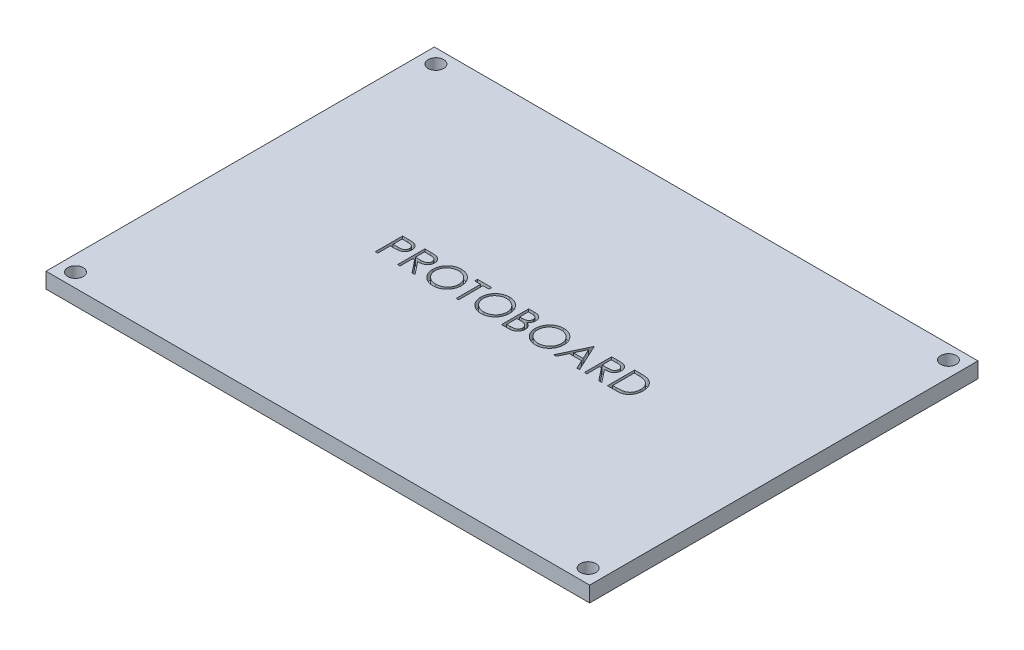
from build123d import *

# Parameters (mm, degrees)
SZKIC1_W                    = 70
SZKIC1_H                    = 50
DODANIE_WYCI_GNI_CIE1_DEPTH = 2
SZKIC2_R                    = 1
WYTNIJ_WYCI_GNI_CIE1_DEPTH  = 2
WYTNIJ_WYCI_GNI_CIE2_DEPTH  = 1


with BuildPart() as part:
    # Szkic1 → Dodanie-wyciągnięcie1 (new body)
    with BuildSketch(Plane(origin=(0, 0, 0), x_dir=(1, 0, 0), z_dir=(0, 1, 0))):
        Rectangle(SZKIC1_W, SZKIC1_H)
    extrude(amount=DODANIE_WYCI_GNI_CIE1_DEPTH)

    # Szkic2 → Wytnij-wyciągnięcie1 (cut)
    with BuildSketch(Plane(origin=(0, 2, 0), x_dir=(1, 0, 0), z_dir=(0, 1, 0))):
        with Locations(Location((-33, 23.2, 0), (0, 0, 270))):
            Circle(SZKIC2_R)
        with Locations(Location((33, 23.2, 0), (0, 0, 270))):
            Circle(SZKIC2_R)
        with Locations(Location((-33, -23.2, 0), (0, 0, 270))):
            Circle(SZKIC2_R)
        with Locations(Location((33, -23.2, 0), (0, 0, 270))):
            Circle(SZKIC2_R)
    extrude(amount=-WYTNIJ_WYCI_GNI_CIE1_DEPTH, mode=Mode.SUBTRACT)

    # Szkic3 → Wytnij-wyciągnięcie2 (cut)
    # profile 1 of 10: a face of its own
    with BuildSketch(Plane(origin=(0, 2, 0), x_dir=(1, 0, 0), z_dir=(0, 1, 0))):
        with BuildLine():
            Line((-15.969316975, 1.87298753), (-15.282918738, 1.87298753))
            add(Edge.make_bspline(
                [(-15.282918738, 1.87298753), (-15.235707831, 1.872935634), (-15.145249639, 1.872836198), (-15.015534583, 1.869821453), (-14.897724851, 1.86579476), (-14.79207447, 1.860212867), (-14.698258372, 1.853616277), (-14.616701073, 1.844364238), (-14.546761516, 1.834703942), (-14.504855067, 1.824882536), (-14.485743257, 1.820403395)],
                knots=[0, 0, 0, 0, 1.415646017, 2.712440637, 3.8905458, 4.950247383, 5.884950622, 6.709939814, 7.411656543, 8, 8, 8, 8], degree=3))
            add(Edge.make_bspline(
                [(-14.485743257, 1.820403395), (-14.461549723, 1.813781446), (-14.413732746, 1.800693584), (-14.344831703, 1.77447986), (-14.279277857, 1.743397695), (-14.216846299, 1.707973755), (-14.158304216, 1.666688191), (-14.102778175, 1.621214574), (-14.050758194, 1.570503005), (-14.002536803, 1.515122265), (-13.958252005, 1.456002055), (-13.920122322, 1.392259825), (-13.888195095, 1.324968522), (-13.860811824, 1.254174951), (-13.841103369, 1.179284627), (-13.82625647, 1.100817915), (-13.816832842, 1.018783225), (-13.81593028, 0.962723357), (-13.815470821, 0.934185447)],
                knots=[0, 0, 0, 0, 0.999701418, 1.975846123, 2.934577507, 3.890451536, 4.834027766, 5.787354733, 6.749476667, 7.726910423, 8.712836071, 9.690891519, 10.682875813, 11.679750201, 12.712814741, 13.765529915, 14.8625177, 16, 16, 16, 16], degree=3))
            add(Edge.make_bspline(
                [(-13.815470821, 0.934185447), (-13.815892246, 0.90540767), (-13.816716792, 0.849102006), (-13.826613077, 0.766729218), (-13.839943269, 0.688010828), (-13.860440321, 0.613121377), (-13.887285994, 0.542505607), (-13.918778047, 0.475084375), (-13.956761577, 0.412004703), (-14.000406407, 0.353037585), (-14.048958001, 0.298127673), (-14.102210939, 0.247672879), (-14.159950232, 0.20196854), (-14.22199238, 0.160912196), (-14.288942229, 0.125455917), (-14.359784382, 0.093698612), (-14.435134599, 0.067027551), (-14.487277113, 0.05299749), (-14.513788129, 0.045864133)],
                knots=[0, 0, 0, 0, 1.121902311, 2.195077645, 3.232258892, 4.234102512, 5.217864754, 6.176164875, 7.132989551, 8.084763148, 9.034132444, 9.988522005, 10.94243251, 11.903244335, 12.886203696, 13.894208494, 14.929344452, 16, 16, 16, 16], degree=3))
            add(Edge.make_bspline(
                [(-14.513788129, 0.045864133), (-14.535715463, 0.041201152), (-14.58377049, 0.030981957), (-14.662913212, 0.019573501), (-14.755058598, 0.0098359), (-14.860080878, 0.002534762), (-14.977885783, -0.003715606), (-15.10853704, -0.0086837), (-15.252291117, -0.011413554), (-15.352562361, -0.011554347), (-15.40491393, -0.011627855)],
                knots=[0, 0, 0, 0, 0.601384939, 1.31797006, 2.144135048, 3.087295005, 4.142315834, 5.309527816, 6.595305764, 8, 8, 8, 8], degree=3))
            Line((-15.40491393, -0.011627855), (-15.655214411, -0.011627855))
            Line((-15.655214411, -0.011627855), (-15.655214411, -1.62701247))
            Line((-15.655214411, -1.62701247), (-15.969316975, -1.62701247))
            Line((-15.969316975, -1.62701247), (-15.969316975, 1.87298753))
        make_face()
        with BuildLine():
            Line((-15.655214411, 1.514013171), (-15.655214411, 0.347346504))
            Line((-15.655214411, 0.347346504), (-15.042433962, 0.339634165))
            add(Edge.make_bspline(
                [(-15.042433962, 0.339634165), (-15.012514036, 0.339618701), (-14.954754236, 0.339588849), (-14.871318013, 0.343574072), (-14.793908726, 0.348174605), (-14.72276415, 0.354910529), (-14.657852216, 0.364431786), (-14.599064687, 0.374043524), (-14.546857404, 0.387948887), (-14.485758202, 0.406671956), (-14.417674855, 0.438604571), (-14.343607306, 0.484954461), (-14.28083672, 0.54403517), (-14.226518423, 0.610463001), (-14.183412545, 0.68436213), (-14.151856553, 0.763431067), (-14.133315396, 0.846858917), (-14.130829202, 0.903947056), (-14.129573385, 0.932783203)],
                knots=[0, 0, 0, 0, 1.160613943, 2.240541288, 3.23993089, 4.169200891, 5.011653406, 5.7853311, 6.478053781, 7.106038997, 8.262395093, 9.384106736, 10.481365981, 11.59014053, 12.70357646, 13.786202915, 14.881775077, 16, 16, 16, 16], degree=3))
            add(Edge.make_bspline(
                [(-14.129573385, 0.932783203), (-14.130836032, 0.960921717), (-14.133346016, 1.016857599), (-14.15200188, 1.098836359), (-14.183351194, 1.177072064), (-14.226807788, 1.250045149), (-14.279548918, 1.316233953), (-14.340848261, 1.37373108), (-14.410561522, 1.419952783), (-14.475409753, 1.449786065), (-14.533010939, 1.46800134), (-14.583042899, 1.48074618), (-14.639533574, 1.490921787), (-14.702501353, 1.499161289), (-14.771458187, 1.506214751), (-14.846996502, 1.511000728), (-14.928830145, 1.513802184), (-14.985640716, 1.513941139), (-15.015090212, 1.514013171)],
                knots=[0, 0, 0, 0, 1.120700087, 2.227813068, 3.331159281, 4.466773991, 5.599788987, 6.693661531, 7.80175334, 8.91857717, 9.525282508, 10.207424825, 10.974604443, 11.810962634, 12.737642355, 13.736264703, 14.826523623, 16, 16, 16, 16], degree=3))
            Line((-15.015090212, 1.514013171), (-15.655214411, 1.514013171))
        make_face(mode=Mode.SUBTRACT)
    # profile 2 of 10: a face of its own
    with BuildSketch(Plane(origin=(0, 2, 0), x_dir=(1, 0, 0), z_dir=(0, 1, 0))):
        with BuildLine():
            Line((-13.097522103, 1.87298753), (-12.39710143, 1.87298753))
            add(Edge.make_bspline(
                [(-12.39710143, 1.87298753), (-12.350360301, 1.872831944), (-12.260612157, 1.872533202), (-12.132038887, 1.870867439), (-12.01521179, 1.866093083), (-11.91019195, 1.8619845), (-11.816981295, 1.854492558), (-11.735294005, 1.847331911), (-11.665506307, 1.83795825), (-11.623260456, 1.829252828), (-11.60413268, 1.825311248)],
                knots=[0, 0, 0, 0, 1.410062039, 2.707475311, 3.878576406, 4.937260626, 5.877586885, 6.699081471, 7.410979367, 8, 8, 8, 8], degree=3))
            add(Edge.make_bspline(
                [(-11.60413268, 1.825311248), (-11.578526056, 1.818984483), (-11.527859066, 1.806465919), (-11.454909, 1.780006318), (-11.385394676, 1.749386694), (-11.319604852, 1.713422973), (-11.257869061, 1.671848194), (-11.19955075, 1.625380071), (-11.144385287, 1.574272865), (-11.094603656, 1.517238024), (-11.047664605, 1.457401514), (-11.008075978, 1.392697757), (-10.973949499, 1.32503623), (-10.946778982, 1.253728812), (-10.924901008, 1.17946704), (-10.909474769, 1.101578243), (-10.900223581, 1.020417268), (-10.899281725, 0.96505936), (-10.898804154, 0.936989934)],
                knots=[0, 0, 0, 0, 1.027469482, 2.033020251, 3.019912614, 3.986113645, 4.951240523, 5.91722682, 6.890402269, 7.87763091, 8.8651537, 9.85103654, 10.82876324, 11.815024772, 12.821070561, 13.842952187, 14.906261191, 16, 16, 16, 16], degree=3))
            add(Edge.make_bspline(
                [(-10.898804154, 0.936989934), (-10.900273152, 0.890354829), (-10.903139548, 0.799357661), (-10.929864652, 0.66729678), (-10.973641172, 0.544107465), (-11.033964461, 0.429944827), (-11.110783936, 0.327034182), (-11.203108727, 0.236643727), (-11.310990339, 0.161003814), (-11.411419655, 0.10855101), (-11.500133855, 0.074958101), (-11.573167167, 0.051321742), (-11.652834145, 0.033059777), (-11.738371479, 0.016699645), (-11.830135135, 0.004347951), (-11.927905174, -0.004698644), (-12.031751326, -0.010352693), (-12.103090395, -0.011194697), (-12.139789731, -0.011627855)],
                knots=[0, 0, 0, 0, 1.260483769, 2.459530307, 3.627416485, 4.787058657, 5.939039949, 7.08810263, 8.267026773, 9.491475466, 10.141966685, 10.831826277, 11.566392101, 12.351337768, 13.187381173, 14.07005841, 15.007169909, 16, 16, 16, 16], degree=3))
            Line((-12.139789731, -0.011627855), (-10.853932359, -1.62701247))
            Line((-10.853932359, -1.62701247), (-11.242353834, -1.62701247))
            Line((-11.242353834, -1.62701247), (-12.528211206, -0.011627855))
            Line((-12.528211206, -0.011627855), (-12.783419539, -0.011627855))
            Line((-12.783419539, -0.011627855), (-12.783419539, -1.62701247))
            Line((-12.783419539, -1.62701247), (-13.097522103, -1.62701247))
            Line((-13.097522103, -1.62701247), (-13.097522103, 1.87298753))
        make_face()
        with BuildLine():
            Line((-12.783419539, 1.514013171), (-12.783419539, 0.347346504))
            Line((-12.783419539, 0.347346504), (-12.142594218, 0.342438652))
            add(Edge.make_bspline(
                [(-12.142594218, 0.342438652), (-12.112674179, 0.342425415), (-12.054680622, 0.342399759), (-11.970779958, 0.346393535), (-11.892659846, 0.350936853), (-11.820619094, 0.357886199), (-11.754625518, 0.366842271), (-11.694712105, 0.378045255), (-11.640781053, 0.391097317), (-11.577882515, 0.411298943), (-11.507645983, 0.443304962), (-11.431314524, 0.48987046), (-11.366312186, 0.548439579), (-11.311394323, 0.615413035), (-11.267264892, 0.689049284), (-11.236152838, 0.768465654), (-11.216410395, 0.851657252), (-11.21408185, 0.908835359), (-11.212906718, 0.937691056)],
                knots=[0, 0, 0, 0, 1.146690395, 2.22261258, 3.21895312, 4.145990853, 4.996080663, 5.770904154, 6.481378293, 7.121626537, 8.300444488, 9.431385265, 10.535395872, 11.636531494, 12.74115979, 13.810798291, 14.895190096, 16, 16, 16, 16], degree=3))
            add(Edge.make_bspline(
                [(-11.212906718, 0.937691056), (-11.214108839, 0.965837629), (-11.216491005, 1.021613868), (-11.235939773, 1.103269778), (-11.268829155, 1.180336729), (-11.313151393, 1.252501214), (-11.367150548, 1.318006949), (-11.43046836, 1.374054102), (-11.501373555, 1.420303567), (-11.567644754, 1.449857948), (-11.626878966, 1.467977801), (-11.678308626, 1.480728965), (-11.736420104, 1.490973434), (-11.801495563, 1.499181495), (-11.873257193, 1.506236439), (-11.952067845, 1.510988217), (-12.037404625, 1.513802082), (-12.096551556, 1.51394117), (-12.127169539, 1.514013171)],
                knots=[0, 0, 0, 0, 1.101028733, 2.181837193, 3.264309656, 4.369019818, 5.486613113, 6.575447106, 7.666700264, 8.788928104, 9.402425223, 10.0903467, 10.862060571, 11.710948788, 12.657782767, 13.684531032, 14.801375019, 16, 16, 16, 16], degree=3))
            Line((-12.127169539, 1.514013171), (-12.783419539, 1.514013171))
        make_face(mode=Mode.SUBTRACT)
    # profile 3 of 10: a face of its own
    with BuildSketch(Plane(origin=(0, 2, 0), x_dir=(1, 0, 0), z_dir=(0, 1, 0))):
        with BuildLine():
            add(Edge.make_bspline(
                [(-8.498163129, 1.96273112), (-8.433355023, 1.96108964), (-8.306066556, 1.95786564), (-8.118991658, 1.933186536), (-7.940396563, 1.890491146), (-7.768826424, 1.833628164), (-7.606333447, 1.757773778), (-7.451694555, 1.66608863), (-7.305277681, 1.557612171), (-7.1690563, 1.433182944), (-7.044399349, 1.29779949), (-6.934573463, 1.15332158), (-6.842531169, 1.000622778), (-6.766945382, 0.840161947), (-6.707646772, 0.672301979), (-6.666727729, 0.496147977), (-6.640589579, 0.312841287), (-6.637533801, 0.187814422), (-6.635983641, 0.124389774)],
                knots=[0, 0, 0, 0, 1.065120563, 2.091984664, 3.0946048, 4.079830382, 5.057816894, 6.036188127, 7.030412546, 8.04752943, 9.064399622, 10.05169764, 11.02544977, 11.989514704, 12.962713494, 13.945757189, 14.957906945, 16, 16, 16, 16], degree=3))
            add(Edge.make_bspline(
                [(-6.635983641, 0.124389774), (-6.637533574, 0.061432327), (-6.640588671, -0.062664093), (-6.666757448, -0.244807537), (-6.707798448, -0.419898234), (-6.766394714, -0.587643887), (-6.841620193, -0.74822145), (-6.934275364, -0.901208404), (-7.043416575, -1.046654903), (-7.167623426, -1.182967568), (-7.303024468, -1.307965038), (-7.448254734, -1.416883914), (-7.600048054, -1.510608039), (-7.760357762, -1.585391713), (-7.927057799, -1.645163633), (-8.101640122, -1.685916263), (-8.283286676, -1.712203306), (-8.40715768, -1.715221822), (-8.470118257, -1.71675606)],
                knots=[0, 0, 0, 0, 1.043624062, 2.057103931, 3.04512605, 4.022047818, 4.998200453, 5.980619268, 6.982898556, 8.009068085, 9.034988726, 10.034168286, 11.015286542, 11.987931943, 12.962482838, 13.94673481, 14.956375938, 16, 16, 16, 16], degree=3))
            add(Edge.make_bspline(
                [(-8.470118257, -1.71675606), (-8.533542576, -1.715206673), (-8.658568792, -1.712152419), (-8.842105827, -1.685971014), (-9.018383571, -1.64502971), (-9.186897922, -1.586520274), (-9.347742852, -1.510903043), (-9.501232934, -1.418698664), (-9.646752082, -1.309291523), (-9.783093828, -1.185124948), (-9.907843026, -1.049953396), (-10.016602402, -0.905119141), (-10.108827515, -0.753463685), (-10.184190848, -0.594566161), (-10.243855307, -0.429194718), (-10.284560125, -0.25624624), (-10.310896077, -0.076706735), (-10.313930924, 0.045536164), (-10.315470821, 0.107562851)],
                knots=[0, 0, 0, 0, 1.053102029, 2.075944431, 3.073151272, 4.055350789, 5.033113405, 6.020478099, 7.024410459, 8.052272461, 9.079885166, 10.07527673, 11.055994387, 12.023226415, 12.992069828, 13.970394897, 14.97016774, 16, 16, 16, 16], degree=3))
            add(Edge.make_bspline(
                [(-10.315470821, 0.107562851), (-10.314936185, 0.14919552), (-10.313873659, 0.231935643), (-10.301081967, 0.354802243), (-10.282520265, 0.475692901), (-10.255918353, 0.594263849), (-10.221126686, 0.710224834), (-10.180074658, 0.824375597), (-10.129934813, 0.93555932), (-10.073254165, 1.044302712), (-10.009992357, 1.148910618), (-9.940116608, 1.247790201), (-9.866081239, 1.341771198), (-9.784917846, 1.428418202), (-9.6993014, 1.510251858), (-9.607843022, 1.586014575), (-9.511100778, 1.656389526), (-9.408658398, 1.719809867), (-9.303040123, 1.777169002), (-9.194163345, 1.826390853), (-9.083506774, 1.868636914), (-8.970552126, 1.90287774), (-8.855599354, 1.929909775), (-8.738397569, 1.948317129), (-8.619040143, 1.961141447), (-8.538628824, 1.962198949), (-8.498163129, 1.96273112)],
                knots=[0, 0, 0, 0, 1.037015668, 2.060948919, 3.074880161, 4.083647147, 5.086022904, 6.090072063, 7.104153813, 8.122640571, 9.144368836, 10.147691507, 11.138137339, 12.123020368, 13.103399296, 14.087645067, 15.080126199, 16.082011238, 17.087798457, 18.072939717, 19.057185487, 20.037253025, 21.01195951, 21.997135196, 22.992090687, 24, 24, 24, 24], degree=3))
        make_face()
        with BuildLine():
            add(Edge.make_bspline(
                [(-8.482738449, 1.603756761), (-8.515953083, 1.603351871), (-8.582064816, 1.602545961), (-8.680349352, 1.591930245), (-8.777341286, 1.576800356), (-8.873060648, 1.555218836), (-8.967106937, 1.525814783), (-9.060356778, 1.491973875), (-9.151959832, 1.450752784), (-9.24161369, 1.40418008), (-9.328528765, 1.352631159), (-9.410541467, 1.295659392), (-9.487864111, 1.234600838), (-9.560307377, 1.169313), (-9.62765855, 1.099463398), (-9.691243251, 1.026110962), (-9.748512833, 0.947159071), (-9.800998409, 0.864748664), (-9.84796625, 0.778987083), (-9.889731604, 0.690777221), (-9.923895613, 0.599399534), (-9.95175799, 0.505845377), (-9.9748578, 0.410262917), (-9.989491724, 0.311927068), (-10.000224084, 0.211331956), (-10.000983929, 0.143350102), (-10.001368257, 0.108965094)],
                knots=[0, 0, 0, 0, 1.008559885, 2.007477868, 2.99961109, 3.989939068, 4.984837346, 5.991145699, 7.001802488, 8.033829008, 9.059044045, 10.069351652, 11.065060232, 12.050310815, 13.029377138, 14.011219647, 14.996725999, 15.989392538, 16.977580475, 17.965360261, 18.951710183, 19.937753436, 20.929683414, 21.935841486, 22.955955122, 24, 24, 24, 24], degree=3))
            add(Edge.make_bspline(
                [(-10.001368257, 0.108965094), (-10.000093395, 0.058402873), (-9.997585347, -0.041068657), (-9.975627777, -0.186836801), (-9.941805802, -0.326925087), (-9.891948436, -0.460566996), (-9.829597821, -0.588911279), (-9.752570931, -0.710819384), (-9.661311845, -0.826324258), (-9.557648319, -0.934619527), (-9.444325612, -1.033465331), (-9.323992882, -1.12022874), (-9.197939275, -1.19363899), (-9.065836072, -1.253444062), (-8.928388533, -1.3008338), (-8.784710982, -1.333312431), (-8.635760523, -1.354687887), (-8.534229867, -1.356740643), (-8.482738449, -1.357781701)],
                knots=[0, 0, 0, 0, 1.032063989, 2.030389145, 3.003944642, 3.970395727, 4.937377036, 5.913328081, 6.909231446, 7.93887556, 8.970685674, 9.976071282, 10.964166581, 11.944589148, 12.933237628, 13.927779006, 14.949070134, 16, 16, 16, 16], degree=3))
            add(Edge.make_bspline(
                [(-8.482738449, -1.357781701), (-8.448128948, -1.357306196), (-8.379487911, -1.356363128), (-8.277392389, -1.346864451), (-8.177136177, -1.331632582), (-8.078859897, -1.309701926), (-7.982675086, -1.28225472), (-7.888180283, -1.249646992), (-7.796381992, -1.208965788), (-7.706122155, -1.164017837), (-7.619725913, -1.112777679), (-7.537250381, -1.05773953), (-7.460774401, -0.996770909), (-7.388385329, -0.932453096), (-7.32075764, -0.863489249), (-7.258348656, -0.789969027), (-7.201368524, -0.711428369), (-7.148902877, -0.629142964), (-7.102099615, -0.543146711), (-7.061320516, -0.454617033), (-7.0267244, -0.363771924), (-6.998795895, -0.270480352), (-6.976910433, -0.174919503), (-6.961830513, -0.076961425), (-6.951282075, 0.023197917), (-6.950486997, 0.090941773), (-6.950086206, 0.125090895)],
                knots=[0, 0, 0, 0, 1.047197238, 2.076906641, 3.100256066, 4.114471768, 5.12198147, 6.126382909, 7.136867548, 8.15857795, 9.17633901, 10.174870724, 11.156907918, 12.133735059, 13.104061851, 14.077631395, 15.04955518, 16.038496417, 17.029181396, 18.010275684, 18.986308667, 19.968651475, 20.955262928, 21.950658345, 22.966943676, 24, 24, 24, 24], degree=3))
            add(Edge.make_bspline(
                [(-6.950086206, 0.125090895), (-6.950487319, 0.1590064), (-6.951283, 0.22628405), (-6.961825475, 0.325744868), (-6.976926365, 0.42299808), (-6.998689073, 0.517661883), (-7.026739227, 0.609760408), (-7.061326557, 0.699207156), (-7.102111857, 0.786335351), (-7.148920081, 0.870929648), (-7.201535904, 0.952104386), (-7.259030148, 1.029706798), (-7.322395496, 1.102279539), (-7.389821521, 1.171614233), (-7.462992406, 1.236232123), (-7.5415767, 1.296154644), (-7.624620378, 1.352827918), (-7.712547613, 1.40395348), (-7.803291567, 1.451167713), (-7.896405525, 1.491618716), (-7.990834625, 1.525990835), (-8.086338737, 1.5553078), (-8.183721715, 1.57671583), (-8.282325544, 1.59194388), (-8.382013803, 1.602542266), (-8.449057023, 1.603350645), (-8.482738449, 1.603756761)],
                knots=[0, 0, 0, 0, 1.02996197, 2.043119294, 3.035359645, 4.018872909, 4.991431989, 5.957985074, 6.929999688, 7.912076566, 8.892894881, 9.867085534, 10.843653904, 11.817741046, 12.803660682, 13.806313499, 14.818574707, 15.856120519, 16.894564902, 17.924820532, 18.937903209, 19.946497019, 20.957711757, 21.963978472, 22.977135795, 24, 24, 24, 24], degree=3))
        make_face(mode=Mode.SUBTRACT)
    # profile 4 of 10: a face of its own
    with BuildSketch(Plane(origin=(0, 2, 0), x_dir=(1, 0, 0), z_dir=(0, 1, 0))):
        Polygon((-6.321881077, 1.514013171), (-6.321881077, 1.87298753), (-4.482137488, 1.87298753), (-4.482137488, 1.514013171), (-5.244958, 1.514013171), (-5.244958, -1.62701247), (-5.559060565, -1.62701247), (-5.559060565, 1.514013171), align=None)
    # profile 5 of 10: a face of its own
    with BuildSketch(Plane(origin=(0, 2, 0), x_dir=(1, 0, 0), z_dir=(0, 1, 0))):
        with BuildLine():
            add(Edge.make_bspline(
                [(-2.305855436, 1.96273112), (-2.24104733, 1.96108964), (-2.113758863, 1.95786564), (-1.926683966, 1.933186536), (-1.74808887, 1.890491146), (-1.576518732, 1.833628164), (-1.414025755, 1.757773778), (-1.259386863, 1.66608863), (-1.112969989, 1.557612171), (-0.976748607, 1.433182944), (-0.852091657, 1.29779949), (-0.742265771, 1.15332158), (-0.650223477, 1.000622778), (-0.57463769, 0.840161947), (-0.51533908, 0.672301979), (-0.474420036, 0.496147977), (-0.448281886, 0.312841287), (-0.445226109, 0.187814422), (-0.443675949, 0.124389774)],
                knots=[0, 0, 0, 0, 1.065120563, 2.091984664, 3.0946048, 4.079830382, 5.057816894, 6.036188127, 7.030412546, 8.04752943, 9.064399622, 10.05169764, 11.02544977, 11.989514704, 12.962713494, 13.945757189, 14.957906945, 16, 16, 16, 16], degree=3))
            add(Edge.make_bspline(
                [(-0.443675949, 0.124389774), (-0.445225882, 0.061432327), (-0.448280978, -0.062664093), (-0.474449756, -0.244807537), (-0.515490756, -0.419898234), (-0.574087022, -0.587643887), (-0.6493125, -0.74822145), (-0.741967672, -0.901208404), (-0.851108882, -1.046654903), (-0.975315733, -1.182967568), (-1.110716775, -1.307965038), (-1.255947042, -1.416883914), (-1.407740362, -1.510608039), (-1.56805007, -1.585391713), (-1.734750107, -1.645163633), (-1.90933243, -1.685916263), (-2.090978984, -1.712203306), (-2.214849988, -1.715221822), (-2.277810565, -1.71675606)],
                knots=[0, 0, 0, 0, 1.043624062, 2.057103931, 3.04512605, 4.022047818, 4.998200453, 5.980619268, 6.982898556, 8.009068085, 9.034988726, 10.034168286, 11.015286542, 11.987931943, 12.962482838, 13.94673481, 14.956375938, 16, 16, 16, 16], degree=3))
            add(Edge.make_bspline(
                [(-2.277810565, -1.71675606), (-2.341234883, -1.715206673), (-2.466261099, -1.712152419), (-2.649798135, -1.685971014), (-2.826075879, -1.64502971), (-2.99459023, -1.586520274), (-3.155435159, -1.510903043), (-3.308925242, -1.418698664), (-3.454444389, -1.309291523), (-3.590786136, -1.185124948), (-3.715535334, -1.049953396), (-3.82429471, -0.905119141), (-3.916519823, -0.753463685), (-3.991883156, -0.594566161), (-4.051547615, -0.429194718), (-4.092252433, -0.25624624), (-4.118588385, -0.076706735), (-4.121623232, 0.045536164), (-4.123163129, 0.107562851)],
                knots=[0, 0, 0, 0, 1.053102029, 2.075944431, 3.073151272, 4.055350789, 5.033113405, 6.020478099, 7.024410459, 8.052272461, 9.079885166, 10.07527673, 11.055994387, 12.023226415, 12.992069828, 13.970394897, 14.97016774, 16, 16, 16, 16], degree=3))
            add(Edge.make_bspline(
                [(-4.123163129, 0.107562851), (-4.122628493, 0.14919552), (-4.121565967, 0.231935643), (-4.108774274, 0.354802243), (-4.090212573, 0.475692901), (-4.063610661, 0.594263849), (-4.028818994, 0.710224834), (-3.987766966, 0.824375597), (-3.937627121, 0.93555932), (-3.880946473, 1.044302712), (-3.817684665, 1.148910618), (-3.747808915, 1.247790201), (-3.673773547, 1.341771198), (-3.592610153, 1.428418202), (-3.506993708, 1.510251858), (-3.41553533, 1.586014575), (-3.318793086, 1.656389526), (-3.216350706, 1.719809867), (-3.110732431, 1.777169002), (-3.001855653, 1.826390853), (-2.891199082, 1.868636914), (-2.778244434, 1.90287774), (-2.663291662, 1.929909775), (-2.546089877, 1.948317129), (-2.426732451, 1.961141447), (-2.346321132, 1.962198949), (-2.305855436, 1.96273112)],
                knots=[0, 0, 0, 0, 1.037015668, 2.060948919, 3.074880161, 4.083647147, 5.086022904, 6.090072063, 7.104153813, 8.122640571, 9.144368836, 10.147691507, 11.138137339, 12.123020368, 13.103399296, 14.087645067, 15.080126199, 16.082011238, 17.087798457, 18.072939717, 19.057185487, 20.037253025, 21.01195951, 21.997135196, 22.992090687, 24, 24, 24, 24], degree=3))
        make_face()
        with BuildLine():
            add(Edge.make_bspline(
                [(-2.290430757, 1.603756761), (-2.32364539, 1.603351871), (-2.389757123, 1.602545961), (-2.48804166, 1.591930245), (-2.585033593, 1.576800356), (-2.680752956, 1.555218836), (-2.774799245, 1.525814783), (-2.868049086, 1.491973875), (-2.95965214, 1.450752784), (-3.049305998, 1.40418008), (-3.136221073, 1.352631159), (-3.218233774, 1.295659392), (-3.295556418, 1.234600838), (-3.367999685, 1.169313), (-3.435350857, 1.099463398), (-3.498935559, 1.026110962), (-3.55620514, 0.947159071), (-3.608690717, 0.864748664), (-3.655658557, 0.778987083), (-3.697423912, 0.690777221), (-3.731587921, 0.599399534), (-3.759450297, 0.505845377), (-3.782550108, 0.410262917), (-3.797184032, 0.311927068), (-3.807916392, 0.211331956), (-3.808676237, 0.143350102), (-3.809060565, 0.108965094)],
                knots=[0, 0, 0, 0, 1.008559885, 2.007477868, 2.99961109, 3.989939068, 4.984837346, 5.991145699, 7.001802488, 8.033829008, 9.059044045, 10.069351652, 11.065060232, 12.050310815, 13.029377138, 14.011219647, 14.996725999, 15.989392538, 16.977580475, 17.965360261, 18.951710183, 19.937753436, 20.929683414, 21.935841486, 22.955955122, 24, 24, 24, 24], degree=3))
            add(Edge.make_bspline(
                [(-3.809060565, 0.108965094), (-3.807785703, 0.058402873), (-3.805277655, -0.041068657), (-3.783320085, -0.186836801), (-3.74949811, -0.326925087), (-3.699640744, -0.460566996), (-3.637290129, -0.588911279), (-3.560263239, -0.710819384), (-3.469004153, -0.826324258), (-3.365340627, -0.934619527), (-3.25201792, -1.033465331), (-3.13168519, -1.12022874), (-3.005631583, -1.19363899), (-2.87352838, -1.253444062), (-2.736080841, -1.3008338), (-2.59240329, -1.333312431), (-2.44345283, -1.354687887), (-2.341922175, -1.356740643), (-2.290430757, -1.357781701)],
                knots=[0, 0, 0, 0, 1.032063989, 2.030389145, 3.003944642, 3.970395727, 4.937377036, 5.913328081, 6.909231446, 7.93887556, 8.970685674, 9.976071282, 10.964166581, 11.944589148, 12.933237628, 13.927779006, 14.949070134, 16, 16, 16, 16], degree=3))
            add(Edge.make_bspline(
                [(-2.290430757, -1.357781701), (-2.255821255, -1.357306196), (-2.187180219, -1.356363128), (-2.085084696, -1.346864451), (-1.984828485, -1.331632582), (-1.886552205, -1.309701926), (-1.790367393, -1.28225472), (-1.69587259, -1.249646992), (-1.6040743, -1.208965788), (-1.513814462, -1.164017837), (-1.427418221, -1.112777679), (-1.344942688, -1.05773953), (-1.268466708, -0.996770909), (-1.196077637, -0.932453096), (-1.128449948, -0.863489249), (-1.066040964, -0.789969027), (-1.009060832, -0.711428369), (-0.956595185, -0.629142964), (-0.909791922, -0.543146711), (-0.869012823, -0.454617033), (-0.834416707, -0.363771924), (-0.806488203, -0.270480352), (-0.784602741, -0.174919503), (-0.769522821, -0.076961425), (-0.758974382, 0.023197917), (-0.758179305, 0.090941773), (-0.757778513, 0.125090895)],
                knots=[0, 0, 0, 0, 1.047197238, 2.076906641, 3.100256066, 4.114471768, 5.12198147, 6.126382909, 7.136867548, 8.15857795, 9.17633901, 10.174870724, 11.156907918, 12.133735059, 13.104061851, 14.077631395, 15.04955518, 16.038496417, 17.029181396, 18.010275684, 18.986308667, 19.968651475, 20.955262928, 21.950658345, 22.966943676, 24, 24, 24, 24], degree=3))
            add(Edge.make_bspline(
                [(-0.757778513, 0.125090895), (-0.758179626, 0.1590064), (-0.758975308, 0.22628405), (-0.769517782, 0.325744868), (-0.784618673, 0.42299808), (-0.806381381, 0.517661883), (-0.834431534, 0.609760408), (-0.869018865, 0.699207156), (-0.909804164, 0.786335351), (-0.956612389, 0.870929648), (-1.009228212, 0.952104386), (-1.066722455, 1.029706798), (-1.130087804, 1.102279539), (-1.197513829, 1.171614233), (-1.270684714, 1.236232123), (-1.349269008, 1.296154644), (-1.432312686, 1.352827918), (-1.520239921, 1.40395348), (-1.610983875, 1.451167713), (-1.704097833, 1.491618716), (-1.798526932, 1.525990835), (-1.894031045, 1.5553078), (-1.991414023, 1.57671583), (-2.090017852, 1.59194388), (-2.189706111, 1.602542266), (-2.25674933, 1.603350645), (-2.290430757, 1.603756761)],
                knots=[0, 0, 0, 0, 1.02996197, 2.043119294, 3.035359645, 4.018872909, 4.991431989, 5.957985074, 6.929999688, 7.912076566, 8.892894881, 9.867085534, 10.843653904, 11.817741046, 12.803660682, 13.806313499, 14.818574707, 15.856120519, 16.894564902, 17.924820532, 18.937903209, 19.946497019, 20.957711757, 21.963978472, 22.977135795, 24, 24, 24, 24], degree=3))
        make_face(mode=Mode.SUBTRACT)
    # profile 6 of 10: a face of its own
    with BuildSketch(Plane(origin=(0, 2, 0), x_dir=(1, 0, 0), z_dir=(0, 1, 0))):
        with BuildLine():
            Line((0.274272769, 1.87298753), (0.957165397, 1.87298753))
            add(Edge.make_bspline(
                [(0.957165397, 1.87298753), (0.990593875, 1.87281178), (1.055386586, 1.872471132), (1.149606027, 1.867188001), (1.237854838, 1.859984331), (1.32015861, 1.848554238), (1.396479313, 1.834762461), (1.46704695, 1.818060645), (1.531637122, 1.798034031), (1.608749859, 1.76618775), (1.69667052, 1.718864582), (1.791868912, 1.648936016), (1.873273152, 1.563403553), (1.943459469, 1.466920898), (1.999260588, 1.360785126), (2.039629886, 1.247525937), (2.065187761, 1.128604195), (2.067816195, 1.046961018), (2.069144564, 1.00569987)],
                knots=[0, 0, 0, 0, 1.001505555, 1.941167018, 2.826882275, 3.653841531, 4.429895133, 5.150066043, 5.825578002, 6.45369114, 7.647487171, 8.808567382, 9.977351308, 11.170798116, 12.373658725, 13.556498008, 14.765093433, 16, 16, 16, 16], degree=3))
            add(Edge.make_bspline(
                [(2.069144564, 1.00569987), (2.068051345, 0.967047314), (2.065903068, 0.891091397), (2.045360309, 0.779997288), (2.01319964, 0.674246069), (1.968494391, 0.574223684), (1.910392395, 0.48219007), (1.841534076, 0.397402804), (1.758457274, 0.323451747), (1.696214034, 0.282108845), (1.664597288, 0.261108524)],
                knots=[0, 0, 0, 0, 1.044552857, 2.05264487, 3.044412934, 4.028983338, 5.005914585, 5.980388656, 6.974128949, 8, 8, 8, 8], degree=3))
            add(Edge.make_bspline(
                [(1.664597288, 0.261108524), (1.704357716, 0.245843525), (1.780429263, 0.2166378), (1.885115275, 0.165002336), (1.97531012, 0.108840226), (2.051707266, 0.047508376), (2.117044921, -0.018600435), (2.174097863, -0.090455549), (2.222779237, -0.168994307), (2.264492161, -0.253397842), (2.297040917, -0.342804311), (2.321416821, -0.436375087), (2.33538427, -0.533774642), (2.337371911, -0.600060021), (2.338375333, -0.633522887)],
                knots=[0, 0, 0, 0, 1.27268992, 2.434971085, 3.483601985, 4.442670788, 5.356604649, 6.2567628, 7.179492994, 8.113709626, 9.066344395, 10.018646069, 10.999752585, 12, 12, 12, 12], degree=3))
            add(Edge.make_bspline(
                [(2.338375333, -0.633522887), (2.337398487, -0.667689759), (2.335476515, -0.734914037), (2.321296543, -0.833669171), (2.297287436, -0.928044118), (2.26421629, -1.018649301), (2.221053975, -1.105309435), (2.168526011, -1.188122699), (2.105894447, -1.26625703), (2.035831578, -1.340580653), (1.956569433, -1.40740844), (1.871053678, -1.466924147), (1.778207358, -1.515870209), (1.679555364, -1.55698623), (1.573991048, -1.588393429), (1.461988441, -1.610366003), (1.343644139, -1.62517104), (1.262434388, -1.626388245), (1.220787192, -1.62701247)],
                knots=[0, 0, 0, 0, 0.978564426, 1.925352924, 2.850884081, 3.763762016, 4.682927383, 5.618979971, 6.567305752, 7.547517671, 8.540179244, 9.531824382, 10.526200242, 11.540722885, 12.589160233, 13.674978461, 14.80764778, 16, 16, 16, 16], degree=3))
            Line((1.220787192, -1.62701247), (0.274272769, -1.62701247))
            Line((0.274272769, -1.62701247), (0.274272769, 1.87298753))
        make_face()
        with BuildLine():
            Line((0.588375333, 1.514013171), (0.588375333, 0.392218299))
            Line((0.588375333, 0.392218299), (0.799412993, 0.392218299))
            add(Edge.make_bspline(
                [(0.799412993, 0.392218299), (0.830261789, 0.392618222), (0.889867948, 0.393390955), (0.976187844, 0.395604472), (1.056312863, 0.401802516), (1.130104696, 0.407998778), (1.19744714, 0.418073365), (1.258191001, 0.430065488), (1.313289598, 0.442748393), (1.376829144, 0.46431788), (1.448902092, 0.496195555), (1.525735196, 0.545667392), (1.593469666, 0.604591745), (1.650666853, 0.672582706), (1.697478324, 0.747448892), (1.729992039, 0.827995773), (1.752039323, 0.912215905), (1.754030855, 0.970034158), (1.755042, 0.999389774)],
                knots=[0, 0, 0, 0, 1.156816544, 2.235205308, 3.236616184, 4.169592532, 5.011045266, 5.787822928, 6.49130361, 7.128639758, 8.301311294, 9.436451833, 10.541879658, 11.654887649, 12.756523258, 13.837046038, 14.901820046, 16, 16, 16, 16], degree=3))
            add(Edge.make_bspline(
                [(1.755042, 0.999389774), (1.754515819, 1.018815545), (1.75348366, 1.056921317), (1.745030357, 1.112470671), (1.730662782, 1.164714424), (1.712208489, 1.214368534), (1.686419801, 1.259880385), (1.656056337, 1.30282358), (1.619370647, 1.341735699), (1.577613334, 1.378105197), (1.529604711, 1.410349725), (1.47537342, 1.438590488), (1.414185743, 1.461331265), (1.347072888, 1.481247417), (1.2730018, 1.495235711), (1.192827247, 1.506889099), (1.105892528, 1.512821841), (1.045747425, 1.513607204), (1.014657384, 1.514013171)],
                knots=[0, 0, 0, 0, 0.91205012, 1.789085906, 2.630437955, 3.453916878, 4.269457761, 5.079663411, 5.91843418, 6.774407191, 7.675494373, 8.627863946, 9.638891023, 10.736472738, 11.911756761, 13.175263542, 14.539845004, 16, 16, 16, 16], degree=3))
            Line((1.014657384, 1.514013171), (0.588375333, 1.514013171))
        make_face(mode=Mode.SUBTRACT)
        with BuildLine():
            Line((0.588375333, 0.03324394), (0.588375333, -1.268038111))
            Line((0.588375333, -1.268038111), (1.035691038, -1.268038111))
            add(Edge.make_bspline(
                [(1.035691038, -1.268038111), (1.067709964, -1.267654364), (1.129422223, -1.266914741), (1.218523453, -1.264500186), (1.301106556, -1.259007911), (1.376794692, -1.250362061), (1.446405145, -1.240983612), (1.509102848, -1.228372331), (1.565396041, -1.21392337), (1.630670349, -1.191589198), (1.704173857, -1.156892727), (1.783384714, -1.104578501), (1.853810932, -1.042255193), (1.913616191, -0.970124279), (1.96262918, -0.891692952), (1.998284635, -0.808547602), (2.020275491, -0.722062075), (2.022937661, -0.663095362), (2.024272769, -0.633522887)],
                knots=[0, 0, 0, 0, 1.160039823, 2.235823828, 3.228722157, 4.157150951, 4.99529583, 5.772374946, 6.472645482, 7.099169577, 8.269452708, 9.405989375, 10.527446681, 11.663510218, 12.788923519, 13.866172445, 14.929861265, 16, 16, 16, 16], degree=3))
            add(Edge.make_bspline(
                [(2.024272769, -0.633522887), (2.023996664, -0.615029546), (2.023448909, -0.578341164), (2.015188294, -0.524425345), (2.003174425, -0.472199472), (1.987642991, -0.421521731), (1.965023524, -0.373308355), (1.938616979, -0.326605795), (1.907655577, -0.281352316), (1.859411411, -0.224140063), (1.789239427, -0.15822305), (1.689532651, -0.093685547), (1.576160353, -0.04163774), (1.49393286, -0.019538264), (1.451456262, -0.008122246)],
                knots=[0, 0, 0, 0, 0.723448775, 1.435228256, 2.130040452, 2.821711965, 3.505591119, 4.210454504, 4.921174351, 5.648778258, 7.137944449, 8.670945889, 10.280296675, 12, 12, 12, 12], degree=3))
            add(Edge.make_bspline(
                [(1.451456262, -0.008122246), (1.434427167, -0.004667162), (1.397504574, 0.002824173), (1.337296994, 0.010731876), (1.268561125, 0.017776936), (1.191138248, 0.022988094), (1.104930407, 0.028374638), (1.009753488, 0.030469459), (0.905996173, 0.032968719), (0.834003801, 0.033149853), (0.796608506, 0.03324394)],
                knots=[0, 0, 0, 0, 0.634451884, 1.375622551, 2.216452059, 3.157844607, 4.20941857, 5.370758133, 6.634282058, 8, 8, 8, 8], degree=3))
            Line((0.796608506, 0.03324394), (0.588375333, 0.03324394))
        make_face(mode=Mode.SUBTRACT)
    # profile 7 of 10: a face of its own
    with BuildSketch(Plane(origin=(0, 2, 0), x_dir=(1, 0, 0), z_dir=(0, 1, 0))):
        with BuildLine():
            add(Edge.make_bspline(
                [(4.694144564, 1.96273112), (4.75895267, 1.96108964), (4.886241137, 1.95786564), (5.073316034, 1.933186536), (5.25191113, 1.890491146), (5.423481268, 1.833628164), (5.585974245, 1.757773778), (5.740613137, 1.66608863), (5.887030011, 1.557612171), (6.023251393, 1.433182944), (6.147908343, 1.29779949), (6.257734229, 1.15332158), (6.349776523, 1.000622778), (6.42536231, 0.840161947), (6.48466092, 0.672301979), (6.525579964, 0.496147977), (6.551718114, 0.312841287), (6.554773891, 0.187814422), (6.556324051, 0.124389774)],
                knots=[0, 0, 0, 0, 1.065120563, 2.091984664, 3.0946048, 4.079830382, 5.057816894, 6.036188127, 7.030412546, 8.04752943, 9.064399622, 10.05169764, 11.02544977, 11.989514704, 12.962713494, 13.945757189, 14.957906945, 16, 16, 16, 16], degree=3))
            add(Edge.make_bspline(
                [(6.556324051, 0.124389774), (6.554774118, 0.061432327), (6.551719022, -0.062664093), (6.525550244, -0.244807537), (6.484509244, -0.419898234), (6.425912978, -0.587643887), (6.3506875, -0.74822145), (6.258032328, -0.901208404), (6.148891118, -1.046654903), (6.024684267, -1.182967568), (5.889283225, -1.307965038), (5.744052958, -1.416883914), (5.592259638, -1.510608039), (5.43194993, -1.585391713), (5.265249893, -1.645163633), (5.09066757, -1.685916263), (4.909021016, -1.712203306), (4.785150012, -1.715221822), (4.722189435, -1.71675606)],
                knots=[0, 0, 0, 0, 1.043624062, 2.057103931, 3.04512605, 4.022047818, 4.998200453, 5.980619268, 6.982898556, 8.009068085, 9.034988726, 10.034168286, 11.015286542, 11.987931943, 12.962482838, 13.94673481, 14.956375938, 16, 16, 16, 16], degree=3))
            add(Edge.make_bspline(
                [(4.722189435, -1.71675606), (4.658765117, -1.715206673), (4.533738901, -1.712152419), (4.350201865, -1.685971014), (4.173924121, -1.64502971), (4.00540977, -1.586520274), (3.844564841, -1.510903043), (3.691074758, -1.418698664), (3.545555611, -1.309291523), (3.409213864, -1.185124948), (3.284464666, -1.049953396), (3.17570529, -0.905119141), (3.083480177, -0.753463685), (3.008116844, -0.594566161), (2.948452385, -0.429194718), (2.907747567, -0.25624624), (2.881411615, -0.076706735), (2.878376768, 0.045536164), (2.876836871, 0.107562851)],
                knots=[0, 0, 0, 0, 1.053102029, 2.075944431, 3.073151272, 4.055350789, 5.033113405, 6.020478099, 7.024410459, 8.052272461, 9.079885166, 10.07527673, 11.055994387, 12.023226415, 12.992069828, 13.970394897, 14.97016774, 16, 16, 16, 16], degree=3))
            add(Edge.make_bspline(
                [(2.876836871, 0.107562851), (2.877371507, 0.14919552), (2.878434033, 0.231935643), (2.891225726, 0.354802243), (2.909787427, 0.475692901), (2.936389339, 0.594263849), (2.971181006, 0.710224834), (3.012233034, 0.824375597), (3.062372879, 0.93555932), (3.119053527, 1.044302712), (3.182315335, 1.148910618), (3.252191085, 1.247790201), (3.326226453, 1.341771198), (3.407389847, 1.428418202), (3.493006292, 1.510251858), (3.58446467, 1.586014575), (3.681206914, 1.656389526), (3.783649294, 1.719809867), (3.889267569, 1.777169002), (3.998144347, 1.826390853), (4.108800918, 1.868636914), (4.221755566, 1.90287774), (4.336708338, 1.929909775), (4.453910123, 1.948317129), (4.573267549, 1.961141447), (4.653678868, 1.962198949), (4.694144564, 1.96273112)],
                knots=[0, 0, 0, 0, 1.037015668, 2.060948919, 3.074880161, 4.083647147, 5.086022904, 6.090072063, 7.104153813, 8.122640571, 9.144368836, 10.147691507, 11.138137339, 12.123020368, 13.103399296, 14.087645067, 15.080126199, 16.082011238, 17.087798457, 18.072939717, 19.057185487, 20.037253025, 21.01195951, 21.997135196, 22.992090687, 24, 24, 24, 24], degree=3))
        make_face()
        with BuildLine():
            add(Edge.make_bspline(
                [(4.709569243, 1.603756761), (4.67635461, 1.603351871), (4.610242877, 1.602545961), (4.51195834, 1.591930245), (4.414966407, 1.576800356), (4.319247044, 1.555218836), (4.225200755, 1.525814783), (4.131950914, 1.491973875), (4.04034786, 1.450752784), (3.950694002, 1.40418008), (3.863778927, 1.352631159), (3.781766226, 1.295659392), (3.704443582, 1.234600838), (3.632000315, 1.169313), (3.564649143, 1.099463398), (3.501064441, 1.026110962), (3.44379486, 0.947159071), (3.391309283, 0.864748664), (3.344341443, 0.778987083), (3.302576088, 0.690777221), (3.268412079, 0.599399534), (3.240549703, 0.505845377), (3.217449892, 0.410262917), (3.202815968, 0.311927068), (3.192083608, 0.211331956), (3.191323763, 0.143350102), (3.190939435, 0.108965094)],
                knots=[0, 0, 0, 0, 1.008559885, 2.007477868, 2.99961109, 3.989939068, 4.984837346, 5.991145699, 7.001802488, 8.033829008, 9.059044045, 10.069351652, 11.065060232, 12.050310815, 13.029377138, 14.011219647, 14.996725999, 15.989392538, 16.977580475, 17.965360261, 18.951710183, 19.937753436, 20.929683414, 21.935841486, 22.955955122, 24, 24, 24, 24], degree=3))
            add(Edge.make_bspline(
                [(3.190939435, 0.108965094), (3.192214297, 0.058402873), (3.194722345, -0.041068657), (3.216679915, -0.186836801), (3.25050189, -0.326925087), (3.300359256, -0.460566996), (3.362709871, -0.588911279), (3.439736761, -0.710819384), (3.530995847, -0.826324258), (3.634659373, -0.934619527), (3.74798208, -1.033465331), (3.86831481, -1.12022874), (3.994368417, -1.19363899), (4.12647162, -1.253444062), (4.263919159, -1.3008338), (4.40759671, -1.333312431), (4.55654717, -1.354687887), (4.658077825, -1.356740643), (4.709569243, -1.357781701)],
                knots=[0, 0, 0, 0, 1.032063989, 2.030389145, 3.003944642, 3.970395727, 4.937377036, 5.913328081, 6.909231446, 7.93887556, 8.970685674, 9.976071282, 10.964166581, 11.944589148, 12.933237628, 13.927779006, 14.949070134, 16, 16, 16, 16], degree=3))
            add(Edge.make_bspline(
                [(4.709569243, -1.357781701), (4.744178745, -1.357306196), (4.812819781, -1.356363128), (4.914915304, -1.346864451), (5.015171515, -1.331632582), (5.113447795, -1.309701926), (5.209632607, -1.28225472), (5.30412741, -1.249646992), (5.3959257, -1.208965788), (5.486185538, -1.164017837), (5.572581779, -1.112777679), (5.655057312, -1.05773953), (5.731533292, -0.996770909), (5.803922363, -0.932453096), (5.871550052, -0.863489249), (5.933959036, -0.789969027), (5.990939168, -0.711428369), (6.043404815, -0.629142964), (6.090208078, -0.543146711), (6.130987177, -0.454617033), (6.165583293, -0.363771924), (6.193511797, -0.270480352), (6.215397259, -0.174919503), (6.230477179, -0.076961425), (6.241025618, 0.023197917), (6.241820695, 0.090941773), (6.242221487, 0.125090895)],
                knots=[0, 0, 0, 0, 1.047197238, 2.076906641, 3.100256066, 4.114471768, 5.12198147, 6.126382909, 7.136867548, 8.15857795, 9.17633901, 10.174870724, 11.156907918, 12.133735059, 13.104061851, 14.077631395, 15.04955518, 16.038496417, 17.029181396, 18.010275684, 18.986308667, 19.968651475, 20.955262928, 21.950658345, 22.966943676, 24, 24, 24, 24], degree=3))
            add(Edge.make_bspline(
                [(6.242221487, 0.125090895), (6.241820374, 0.1590064), (6.241024692, 0.22628405), (6.230482218, 0.325744868), (6.215381327, 0.42299808), (6.193618619, 0.517661883), (6.165568466, 0.609760408), (6.130981135, 0.699207156), (6.090195836, 0.786335351), (6.043387611, 0.870929648), (5.990771788, 0.952104386), (5.933277545, 1.029706798), (5.869912196, 1.102279539), (5.802486171, 1.171614233), (5.729315286, 1.236232123), (5.650730992, 1.296154644), (5.567687314, 1.352827918), (5.479760079, 1.40395348), (5.389016125, 1.451167713), (5.295902167, 1.491618716), (5.201473068, 1.525990835), (5.105968955, 1.5553078), (5.008585977, 1.57671583), (4.909982148, 1.59194388), (4.810293889, 1.602542266), (4.74325067, 1.603350645), (4.709569243, 1.603756761)],
                knots=[0, 0, 0, 0, 1.02996197, 2.043119294, 3.035359645, 4.018872909, 4.991431989, 5.957985074, 6.929999688, 7.912076566, 8.892894881, 9.867085534, 10.843653904, 11.817741046, 12.803660682, 13.806313499, 14.818574707, 15.856120519, 16.894564902, 17.924820532, 18.937903209, 19.946497019, 20.957711757, 21.963978472, 22.977135795, 24, 24, 24, 24], degree=3))
        make_face(mode=Mode.SUBTRACT)
    # profile 8 of 10: a face of its own
    with BuildSketch(Plane(origin=(0, 2, 0), x_dir=(1, 0, 0), z_dir=(0, 1, 0))):
        Polygon((8.710170205, 1.87298753), (10.32555482, -1.62701247), (9.984108506, -1.62701247), (9.466680621, -0.505217598), (7.880042, -0.505217598), (7.348591679, -1.62701247), (7.005042, -1.62701247), (8.66529841, 1.87298753), align=None)
        Polygon((8.684228698, 1.190094902), (8.051115718, -0.146243239), (9.301215878, -0.146243239), align=None, mode=Mode.SUBTRACT)
    # profile 9 of 10: a face of its own
    with BuildSketch(Plane(origin=(0, 2, 0), x_dir=(1, 0, 0), z_dir=(0, 1, 0))):
        with BuildLine():
            Line((10.953759948, 1.87298753), (11.654180621, 1.87298753))
            add(Edge.make_bspline(
                [(11.654180621, 1.87298753), (11.70092175, 1.872831944), (11.790669894, 1.872533202), (11.919243165, 1.870867439), (12.036070262, 1.866093083), (12.141090101, 1.8619845), (12.234300756, 1.854492558), (12.315988047, 1.847331911), (12.385775744, 1.83795825), (12.428021596, 1.829252828), (12.447149371, 1.825311248)],
                knots=[0, 0, 0, 0, 1.410062039, 2.707475311, 3.878576406, 4.937260626, 5.877586885, 6.699081471, 7.410979367, 8, 8, 8, 8], degree=3))
            add(Edge.make_bspline(
                [(12.447149371, 1.825311248), (12.472755996, 1.818984483), (12.523422985, 1.806465919), (12.596373051, 1.780006318), (12.665887375, 1.749386694), (12.731677199, 1.713422973), (12.79341299, 1.671848194), (12.851731301, 1.625380071), (12.906896765, 1.574272865), (12.956678395, 1.517238024), (13.003617447, 1.457401514), (13.043206073, 1.392697757), (13.077332553, 1.32503623), (13.10450307, 1.253728812), (13.126381043, 1.17946704), (13.141807283, 1.101578243), (13.15105847, 1.020417268), (13.152000326, 0.96505936), (13.152477897, 0.936989934)],
                knots=[0, 0, 0, 0, 1.027469482, 2.033020251, 3.019912614, 3.986113645, 4.951240523, 5.91722682, 6.890402269, 7.87763091, 8.8651537, 9.85103654, 10.82876324, 11.815024772, 12.821070561, 13.842952187, 14.906261191, 16, 16, 16, 16], degree=3))
            add(Edge.make_bspline(
                [(13.152477897, 0.936989934), (13.151008899, 0.890354829), (13.148142503, 0.799357661), (13.121417399, 0.66729678), (13.07764088, 0.544107465), (13.017317591, 0.429944827), (12.940498115, 0.327034182), (12.848173324, 0.236643727), (12.740291712, 0.161003814), (12.639862396, 0.10855101), (12.551148197, 0.074958101), (12.478114884, 0.051321742), (12.398447906, 0.033059777), (12.312910572, 0.016699645), (12.221146916, 0.004347951), (12.123376877, -0.004698644), (12.019530725, -0.010352693), (11.948191656, -0.011194697), (11.91149232, -0.011627855)],
                knots=[0, 0, 0, 0, 1.260483769, 2.459530307, 3.627416485, 4.787058657, 5.939039949, 7.08810263, 8.267026773, 9.491475466, 10.141966685, 10.831826277, 11.566392101, 12.351337768, 13.187381173, 14.07005841, 15.007169909, 16, 16, 16, 16], degree=3))
            Line((11.91149232, -0.011627855), (13.197349692, -1.62701247))
            Line((13.197349692, -1.62701247), (12.808928218, -1.62701247))
            Line((12.808928218, -1.62701247), (11.523070846, -0.011627855))
            Line((11.523070846, -0.011627855), (11.267862512, -0.011627855))
            Line((11.267862512, -0.011627855), (11.267862512, -1.62701247))
            Line((11.267862512, -1.62701247), (10.953759948, -1.62701247))
            Line((10.953759948, -1.62701247), (10.953759948, 1.87298753))
        make_face()
        with BuildLine():
            Line((11.267862512, 1.514013171), (11.267862512, 0.347346504))
            Line((11.267862512, 0.347346504), (11.908687833, 0.342438652))
            add(Edge.make_bspline(
                [(11.908687833, 0.342438652), (11.938607872, 0.342425415), (11.996601429, 0.342399759), (12.080502094, 0.346393535), (12.158622205, 0.350936853), (12.230662958, 0.357886199), (12.296656533, 0.366842271), (12.356569946, 0.378045255), (12.410500998, 0.391097317), (12.473399536, 0.411298943), (12.543636068, 0.443304962), (12.619967528, 0.48987046), (12.684969865, 0.548439579), (12.739887728, 0.615413035), (12.784017159, 0.689049284), (12.815129214, 0.768465654), (12.834871656, 0.851657252), (12.837200201, 0.908835359), (12.838375333, 0.937691056)],
                knots=[0, 0, 0, 0, 1.146690395, 2.22261258, 3.21895312, 4.145990853, 4.996080663, 5.770904154, 6.481378293, 7.121626537, 8.300444488, 9.431385265, 10.535395872, 11.636531494, 12.74115979, 13.810798291, 14.895190096, 16, 16, 16, 16], degree=3))
            add(Edge.make_bspline(
                [(12.838375333, 0.937691056), (12.837173212, 0.965837629), (12.834791046, 1.021613868), (12.815342278, 1.103269778), (12.782452897, 1.180336729), (12.738130659, 1.252501214), (12.684131504, 1.318006949), (12.620813691, 1.374054102), (12.549908496, 1.420303567), (12.483637298, 1.449857948), (12.424403085, 1.467977801), (12.372973425, 1.480728965), (12.314861947, 1.490973434), (12.249786489, 1.499181495), (12.178024858, 1.506236439), (12.099214207, 1.510988217), (12.013877427, 1.513802082), (11.954730495, 1.51394117), (11.924112512, 1.514013171)],
                knots=[0, 0, 0, 0, 1.101028733, 2.181837193, 3.264309656, 4.369019818, 5.486613113, 6.575447106, 7.666700264, 8.788928104, 9.402425223, 10.0903467, 10.862060571, 11.710948788, 12.657782767, 13.684531032, 14.801375019, 16, 16, 16, 16], degree=3))
            Line((11.924112512, 1.514013171), (11.267862512, 1.514013171))
        make_face(mode=Mode.SUBTRACT)
    # profile 10 of 10: a face of its own
    with BuildSketch(Plane(origin=(0, 2, 0), x_dir=(1, 0, 0), z_dir=(0, 1, 0))):
        with BuildLine():
            Line((13.91529841, -1.62701247), (13.91529841, 1.87298753))
            Line((13.91529841, 1.87298753), (14.622029179, 1.87298753))
            add(Edge.make_bspline(
                [(14.622029179, 1.87298753), (14.683498167, 1.87254496), (14.802255933, 1.871689917), (14.97386838, 1.866268526), (15.132652143, 1.85667806), (15.278085002, 1.842708534), (15.410566214, 1.8255555), (15.529724822, 1.804055096), (15.636176965, 1.778666926), (15.701646405, 1.757021475), (15.732606102, 1.746785607)],
                knots=[0, 0, 0, 0, 1.314313732, 2.53924729, 3.670748893, 4.714932338, 5.66265055, 6.526160246, 7.303039223, 8, 8, 8, 8], degree=3))
            add(Edge.make_bspline(
                [(15.732606102, 1.746785607), (15.773100841, 1.731354901), (15.853172034, 1.700843407), (15.967179156, 1.643287106), (16.074504519, 1.578074004), (16.175723664, 1.505118142), (16.268524491, 1.422353793), (16.356532387, 1.333296707), (16.436147111, 1.234708367), (16.509055407, 1.128633379), (16.574791067, 1.016321327), (16.631930224, 0.897986218), (16.679384218, 0.77422901), (16.718777444, 0.645393862), (16.749823902, 0.511197484), (16.771005834, 0.371483618), (16.784976823, 0.226804429), (16.786380875, 0.128629965), (16.787093282, 0.078816857)],
                knots=[0, 0, 0, 0, 0.984719456, 1.947108742, 2.898477687, 3.838006223, 4.779231079, 5.722358779, 6.681677486, 7.655904652, 8.64651281, 9.637519902, 10.640069247, 11.656948941, 12.698408672, 13.768548281, 14.867775369, 16, 16, 16, 16], degree=3))
            add(Edge.make_bspline(
                [(16.787093282, 0.078816857), (16.786464314, 0.035555619), (16.785224868, -0.04969517), (16.774095552, -0.175336066), (16.757919232, -0.297249637), (16.732875034, -0.414855337), (16.702472521, -0.529183555), (16.66350837, -0.6390158), (16.618872873, -0.745359609), (16.566822995, -0.846777085), (16.50968161, -0.942860457), (16.448359867, -1.033435985), (16.382923171, -1.117211207), (16.312747538, -1.194439819), (16.238739822, -1.265005398), (16.160415491, -1.329497413), (16.077572441, -1.386653968), (15.990581718, -1.438721076), (15.896905589, -1.484141432), (15.794769722, -1.522571441), (15.683738544, -1.554418057), (15.564084587, -1.580988952), (15.43560111, -1.602066255), (15.298162144, -1.616192648), (15.151978854, -1.62574558), (15.051599589, -1.626581974), (14.999933827, -1.62701247)],
                knots=[0, 0, 0, 0, 1.105936401, 2.179363191, 3.223086493, 4.248585256, 5.251745608, 6.245858792, 7.225916811, 8.198733463, 9.158002045, 10.082870192, 10.993790845, 11.873723703, 12.748670949, 13.606408763, 14.465103618, 15.319838547, 16.196477973, 17.123216899, 18.106603292, 19.147568657, 20.255746949, 21.433717677, 22.679120308, 24, 24, 24, 24], degree=3))
            Line((14.999933827, -1.62701247), (13.91529841, -1.62701247))
        make_face()
        with BuildLine():
            Line((14.229400974, -1.268038111), (14.631143762, -1.268038111))
            add(Edge.make_bspline(
                [(14.631143762, -1.268038111), (14.688872133, -1.267790015), (14.799904932, -1.267312834), (14.959562929, -1.263125631), (15.105442325, -1.256283694), (15.237563835, -1.246708616), (15.355852859, -1.234040001), (15.460556609, -1.219915098), (15.551331867, -1.202317647), (15.606261304, -1.186366688), (15.631644564, -1.178995643)],
                knots=[0, 0, 0, 0, 1.375205317, 2.645023457, 3.804390687, 4.853969522, 5.800190428, 6.637939096, 7.370582563, 8, 8, 8, 8], degree=3))
            add(Edge.make_bspline(
                [(15.631644564, -1.178995643), (15.663592926, -1.167744085), (15.726726564, -1.145509711), (15.817607649, -1.10495205), (15.902364654, -1.056909981), (15.982474679, -1.003507707), (16.056801335, -0.942861705), (16.126225451, -0.876290716), (16.190607252, -0.803455941), (16.24928156, -0.724447779), (16.301789864, -0.639757983), (16.347261094, -0.55021915), (16.387112625, -0.45681234), (16.418391218, -0.358103181), (16.442906802, -0.254974123), (16.46027149, -0.147417909), (16.471086214, -0.035454627), (16.472347662, 0.040697497), (16.472990718, 0.079517979)],
                knots=[0, 0, 0, 0, 0.998632004, 1.973411704, 2.929992603, 3.868527914, 4.809262121, 5.754881198, 6.702106254, 7.672490631, 8.653608572, 9.636854334, 10.631411391, 11.644891563, 12.686317036, 13.754757253, 14.855430412, 16, 16, 16, 16], degree=3))
            add(Edge.make_bspline(
                [(16.472990718, 0.079517979), (16.47247743, 0.120451459), (16.471469073, 0.200865643), (16.458794762, 0.318856339), (16.440273207, 0.432336989), (16.413489521, 0.541315185), (16.379358642, 0.646003537), (16.336764, 0.745823047), (16.288097381, 0.841827916), (16.230194044, 0.931802282), (16.166778451, 1.016895391), (16.096400571, 1.094850306), (16.020178533, 1.165844607), (15.938943683, 1.230983919), (15.850406584, 1.287647595), (15.756652893, 1.338334276), (15.656307222, 1.381350168), (15.586494526, 1.40422903), (15.551015557, 1.41585612)],
                knots=[0, 0, 0, 0, 1.122418816, 2.205001699, 3.251619955, 4.274784885, 5.280384055, 6.268708349, 7.249350384, 8.229342522, 9.199999885, 10.157847722, 11.105861043, 12.055065948, 13.010012805, 13.98527497, 14.976112212, 16, 16, 16, 16], degree=3))
            add(Edge.make_bspline(
                [(15.551015557, 1.41585612), (15.521664411, 1.423972548), (15.459255821, 1.4412303), (15.357416357, 1.460055673), (15.242801207, 1.476660172), (15.114901506, 1.490718211), (14.973863047, 1.500805533), (14.819577359, 1.508376847), (14.651977754, 1.51348348), (14.535795221, 1.513832187), (14.475494724, 1.514013171)],
                knots=[0, 0, 0, 0, 0.674548936, 1.434276114, 2.292660221, 3.240891867, 4.284742987, 5.42552168, 6.663806718, 8, 8, 8, 8], degree=3))
            Line((14.475494724, 1.514013171), (14.229400974, 1.514013171))
            Line((14.229400974, 1.514013171), (14.229400974, -1.268038111))
        make_face(mode=Mode.SUBTRACT)
    extrude(amount=-WYTNIJ_WYCI_GNI_CIE2_DEPTH, mode=Mode.SUBTRACT)


solid = part.part
